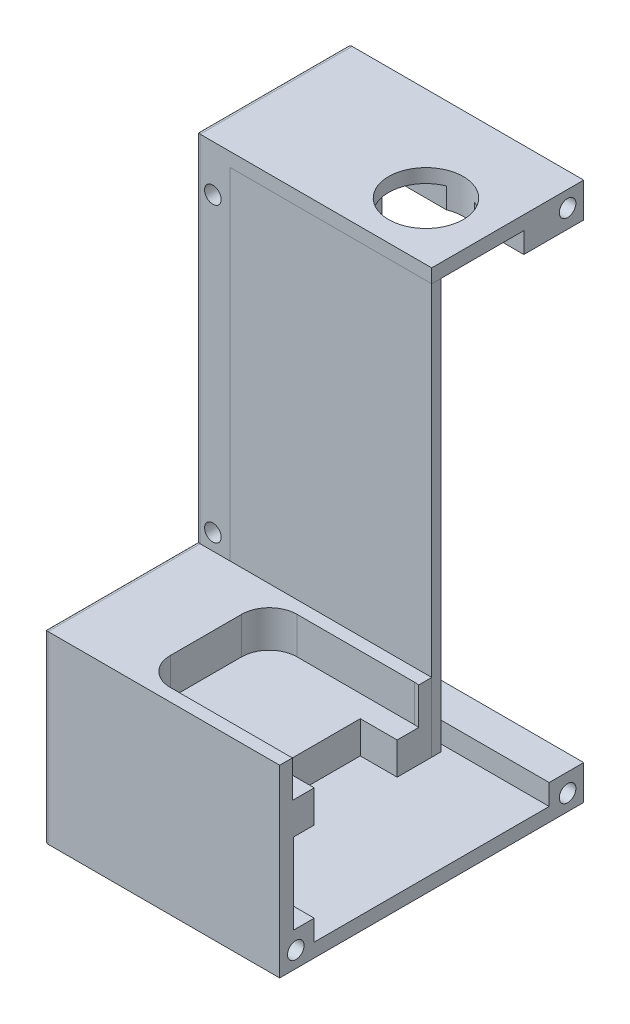
from build123d import *

# Parameters (mm, degrees)
SKETCH_1_W           = 33
SKETCH_1_H           = 25
SKETCH_1_W_2         = 23
SKETCH_1_H_2         = 117
SKETCH_1_W_3         = 10
EXTRUDE_1_DEPTH      = 77
SKETCH_2_W           = 62
SKETCH_2_H           = 62
CUT_EXTRUDE_1_DEPTH  = 10
SKETCH_3_R           = 8.1
CUT_EXTRUDE_2_DEPTH  = 10
SKETCH_4_W           = 62
SKETCH_4_H           = 40
CUT_EXTRUDE_3_DEPTH  = 58.5
SKETCH_5_W           = 77
SKETCH_5_H           = 33
EXTRUDE_2_DEPTH      = 15
EXTRUDE_3_DEPTH      = 7
SKETCH_7_W           = 62
SKETCH_7_H           = 66.5
CUT_EXTRUDE_4_DEPTH  = 20
SKETCH_8_W           = 62
SKETCH_8_H           = 2
EXTRUDE_4_DEPTH      = 89
SKETCH_9_R           = 1.8
CUT_EXTRUDE_5_DEPTH  = 125.426685241
SKETCH_10_R          = 1.8
CUT_EXTRUDE_6_DEPTH  = 125.426685241
SKETCH_12_R          = 1.8
CUT_EXTRUDE_7_DEPTH  = 3
SKETCH_13_W          = 7.5
SKETCH_13_H          = 11.5
CUT_EXTRUDE_8_DEPTH  = 10
CUT_EXTRUDE_9_DEPTH  = 25.75
SKETCH_17_W          = 43.75
SKETCH_17_H          = 51
CUT_EXTRUDE_11_DEPTH = 4.5
SKETCH_18_W          = 43.75
SKETCH_18_H          = 17.5
CUT_EXTRUDE_12_DEPTH = 4.5
SKETCH_19_W          = 35.75
SKETCH_19_H          = 62
CUT_EXTRUDE_13_DEPTH = 3
FILLET_1_R           = 1


with BuildPart() as part:
    # ｽｹｯﾁ1 → ﾎﾞｽ - 押し出し1 (new body)
    with BuildSketch(Plane(origin=(0, 0, 0), x_dir=(0, 0, -1), z_dir=(1, 0, 0))):
        with Locations((-16.5, -12.5)):
            Rectangle(SKETCH_1_W, SKETCH_1_H)
        with Locations((11.5, 33.5)):
            Rectangle(SKETCH_1_W_2, SKETCH_1_H_2)
        with Locations((28, 33.5)):
            Rectangle(SKETCH_1_W_3, SKETCH_1_H_2)
    extrude(amount=EXTRUDE_1_DEPTH)

    # ｽｹｯﾁ2 → ｶｯﾄ - 押し出し1 (cut)
    with BuildSketch(Plane(origin=(0, 0, -33), x_dir=(-1, 0, 0), z_dir=(0, 0, -1))):
        with Locations((-38.5, 53.5)):
            Rectangle(SKETCH_2_W, SKETCH_2_H)
    extrude(amount=-CUT_EXTRUDE_1_DEPTH, mode=Mode.SUBTRACT)

    # ｽｹｯﾁ3 → ｶｯﾄ - 押し出し2 (cut)
    with BuildSketch(Plane(origin=(0, 92, 0), x_dir=(1, 0, 0), z_dir=(0, 1, 0))):
        with Locations(Location((37.5, 12.5, 0), (0, 0, 270))):
            Circle(SKETCH_3_R)
    extrude(amount=-CUT_EXTRUDE_2_DEPTH, mode=Mode.SUBTRACT)

    # ｽｹｯﾁ4 → ｶｯﾄ - 押し出し3 (cut)
    with BuildSketch(Plane(origin=(0, 0, -33), x_dir=(-1, 0, 0), z_dir=(0, 0, -1))):
        with Locations((-38.5, 2.5)):
            Rectangle(SKETCH_4_W, SKETCH_4_H)
    extrude(amount=-CUT_EXTRUDE_3_DEPTH, mode=Mode.SUBTRACT)

    # ｽｹｯﾁ5 → ﾎﾞｽ - 押し出し2 (add)
    with BuildSketch(Plane(origin=(0, 0, 0), x_dir=(1, 0, 0), z_dir=(0, 1, 0))):
        with Locations((38.5, -16.5)):
            Rectangle(SKETCH_5_W, SKETCH_5_H)
        with BuildLine():
            Line((50.25, -2.75), (24.75, -2.75))
            ThreePointArc((24.75, -2.75), (20.507359313, -4.507359313), (18.75, -8.75))
            Line((18.75, -8.75), (18.75, -24.25))
            ThreePointArc((18.75, -24.25), (20.507359313, -28.492640687), (24.75, -30.25))
            Line((24.75, -30.25), (50.25, -30.25))
            ThreePointArc((50.25, -30.25), (54.492640687, -28.492640687), (56.25, -24.25))
            Line((56.25, -24.25), (56.25, -8.75))
            ThreePointArc((56.25, -8.75), (54.492640687, -4.507359313), (50.25, -2.75))
        make_face(mode=Mode.SUBTRACT)
    extrude(amount=EXTRUDE_2_DEPTH)

    # ｽｹｯﾁ6 → ﾎﾞｽ - 押し出し3 (add)
    with BuildSketch(Plane(origin=(0, 0, 0), x_dir=(1, 0, 0), z_dir=(0, 1, 0))):
        with BuildLine():
            Line((18.881652703, -25.5), (43.25, -25.5))
            Line((43.25, -25.5), (43.25, -7.5))
            Line((43.25, -7.5), (43.25, -2.75))
            Line((43.25, -2.75), (24.75, -2.75))
            ThreePointArc((24.75, -2.75), (20.507359313, -4.507359313), (18.75, -8.75))
            Line((18.75, -8.75), (18.75, -24.25))
            ThreePointArc((18.75, -24.25), (18.783003947, -24.878456927), (18.881652703, -25.5))
        make_face()
        with BuildLine():
            Line((24.75, -30.25), (43.25, -30.25))
            Line((43.25, -30.25), (43.25, -25.5))
            Line((43.25, -25.5), (18.881652703, -25.5))
            ThreePointArc((18.881652703, -25.5), (20.975082782, -28.913689527), (24.75, -30.25))
        make_face()
        with BuildLine():
            Line((43.25, -25.5), (43.25, -30.25))
            Line((43.25, -30.25), (50.25, -30.25))
            ThreePointArc((50.25, -30.25), (50.751757562, -30.228983137), (51.25, -30.166079783))
            Line((51.25, -30.166079783), (51.25, -25.5))
            Line((51.25, -25.5), (43.25, -25.5))
        make_face()
        with BuildLine():
            Line((51.25, -7.5), (51.25, -25.5))
            Line((51.25, -25.5), (56.118347297, -25.5))
            ThreePointArc((56.118347297, -25.5), (56.216996053, -24.878456927), (56.25, -24.25))
            Line((56.25, -24.25), (56.25, -8.75))
            ThreePointArc((56.25, -8.75), (54.832575695, -4.877016654), (51.25, -2.833920217))
            Line((51.25, -2.833920217), (51.25, -7.5))
        make_face()
        with BuildLine():
            Line((56.118347297, -25.5), (51.25, -25.5))
            Line((51.25, -25.5), (51.25, -30.166079783))
            ThreePointArc((51.25, -30.166079783), (54.401701312, -28.581671296), (56.118347297, -25.5))
        make_face()
        with BuildLine():
            Line((43.25, -2.75), (43.25, -7.5))
            Line((43.25, -7.5), (51.25, -7.5))
            Line((51.25, -7.5), (51.25, -2.833920217))
            ThreePointArc((51.25, -2.833920217), (50.751757562, -2.771016863), (50.25, -2.75))
            Line((50.25, -2.75), (43.25, -2.75))
        make_face()
    extrude(amount=EXTRUDE_3_DEPTH)

    # ｽｹｯﾁ7 → ｶｯﾄ - 押し出し4 (cut)
    with BuildSketch(Plane.XY):
        with Locations((38.5, 55.75)):
            Rectangle(SKETCH_7_W, SKETCH_7_H)
    extrude(amount=-CUT_EXTRUDE_4_DEPTH, mode=Mode.SUBTRACT)

    # ｽｹｯﾁ9 → ｶｯﾄ - 押し出し5 (cut, through all)
    with BuildSketch(Plane.ZY):
        with Locations((-29.5, 88.5)):
            Circle(SKETCH_9_R)
        with Locations((-29.5, -21.5)):
            Circle(SKETCH_9_R)
        with Locations((29.5, -21.5)):
            Circle(SKETCH_9_R)
    extrude(amount=-CUT_EXTRUDE_5_DEPTH, mode=Mode.SUBTRACT)

    # ｽｹｯﾁ10 → ｶｯﾄ - 押し出し6 (cut, through all)
    with BuildSketch(Plane.XY):
        with Locations((3.75, 82)):
            Circle(SKETCH_10_R)
        with Locations((73.25, 82)):
            Circle(SKETCH_10_R)
        with Locations((73.25, 18.5)):
            Circle(SKETCH_10_R)
        with Locations((3.75, 18.5)):
            Circle(SKETCH_10_R)
    extrude(amount=-CUT_EXTRUDE_6_DEPTH, mode=Mode.SUBTRACT)

    # ｽｹｯﾁ12 → ｶｯﾄ - 押し出し7 (cut)
    with BuildSketch(Plane(origin=(0, 0, -23), x_dir=(-1, 0, 0), z_dir=(0, 0, -1))):
        with Locations(Location((-66.5, 81.5, 0), (0, 0, 90))):
            Circle(SKETCH_12_R)
        with Locations(Location((-11.5, 81.5, 0), (0, 0, 90))):
            Circle(SKETCH_12_R)
        with Locations(Location((-11.5, 26.5, 0), (0, 0, 90))):
            Circle(SKETCH_12_R)
        with Locations(Location((-66.5, 26.5, 0), (0, 0, 90))):
            Circle(SKETCH_12_R)
    extrude(amount=-CUT_EXTRUDE_7_DEPTH, mode=Mode.SUBTRACT)

    # ｽｹｯﾁ13 → ｶｯﾄ - 押し出し8 (cut)
    with BuildSketch(Plane(origin=(0, 0, -33), x_dir=(-1, 0, 0), z_dir=(0, 0, -1))):
        with Locations((-3.75, 36.25)):
            Rectangle(SKETCH_13_W, SKETCH_13_H)
    extrude(amount=-CUT_EXTRUDE_8_DEPTH, mode=Mode.SUBTRACT)


with BuildPart() as body_2:
    # ｽｹｯﾁ8 → ﾎﾞｽ - 押し出し4 (new body)
    with BuildSketch(Plane(origin=(0, 89, 0), x_dir=(-1, 0, 0), z_dir=(0, -1, 0))):
        with Locations((-38.5, 1)):
            Rectangle(SKETCH_8_W, SKETCH_8_H)
    extrude(amount=EXTRUDE_4_DEPTH)


with BuildPart() as cut_extrude_9_tool:
    # ｽｹｯﾁ15 → ｶｯﾄ - 押し出し9 (new body)
    with BuildSketch(Plane(origin=(77, 0, 0), x_dir=(0, 0, -1), z_dir=(1, 0, 0))):
        Polygon((0, 15), (-33, 15), (-33, -25), (33, -25), (33, 92), (0, 92), align=None)
    extrude(amount=-CUT_EXTRUDE_9_DEPTH)


with BuildPart() as part_1:
    add(part.part)

    # ｶｯﾄ - 押し出し9: cut by cut_extrude_9_tool
    add(cut_extrude_9_tool.part, mode=Mode.SUBTRACT)

    # ｽｹｯﾁ17 → ｶｯﾄ - 押し出し11 (cut)
    with BuildSketch(Plane(origin=(0, -17.5, 0), x_dir=(1, 0, 0), z_dir=(0, 1, 0))):
        with Locations((29.375, 0)):
            Rectangle(SKETCH_17_W, SKETCH_17_H)
    extrude(amount=-CUT_EXTRUDE_11_DEPTH, mode=Mode.SUBTRACT)

    # ｽｹｯﾁ18 → ｶｯﾄ - 押し出し12 (cut)
    with BuildSketch(Plane(origin=(0, 0, 25.5), x_dir=(-1, 0, 0), z_dir=(0, 0, -1))):
        with Locations((-29.375, -8.75)):
            Rectangle(SKETCH_18_W, SKETCH_18_H)
    extrude(amount=-CUT_EXTRUDE_12_DEPTH, mode=Mode.SUBTRACT)

    # ｽｹｯﾁ19 → ｶｯﾄ - 押し出し13 (cut)
    with BuildSketch(Plane(origin=(0, 0, -23), x_dir=(-1, 0, 0), z_dir=(0, 0, -1))):
        with Locations((-33.375, 53.5)):
            Rectangle(SKETCH_19_W, SKETCH_19_H)
    extrude(amount=-CUT_EXTRUDE_13_DEPTH, mode=Mode.SUBTRACT)

    # ﾌｨﾚｯﾄ1
    fillet_1_edges = [part_1.edges().sort_by_distance(p)[0] for p in [
        (0, -5, 33),
        (0, 2.75, -33),
        (0, 36.25, -23),
        (0, 42, -28),
        (0, 30.5, -28),
        (0, 15, 16.5),
        (0, 53.5, 0),
        (0, 92, -16.5),
        (0, 67, -33),
        (0, -25, 0),
    ]]
    fillet(fillet_1_edges, radius=FILLET_1_R)


with BuildPart() as body_2_1:
    add(body_2.part)

    # ｶｯﾄ - 押し出し9: cut by cut_extrude_9_tool
    add(cut_extrude_9_tool.part, mode=Mode.SUBTRACT)


solid = Compound([part_1.part, body_2_1.part])
